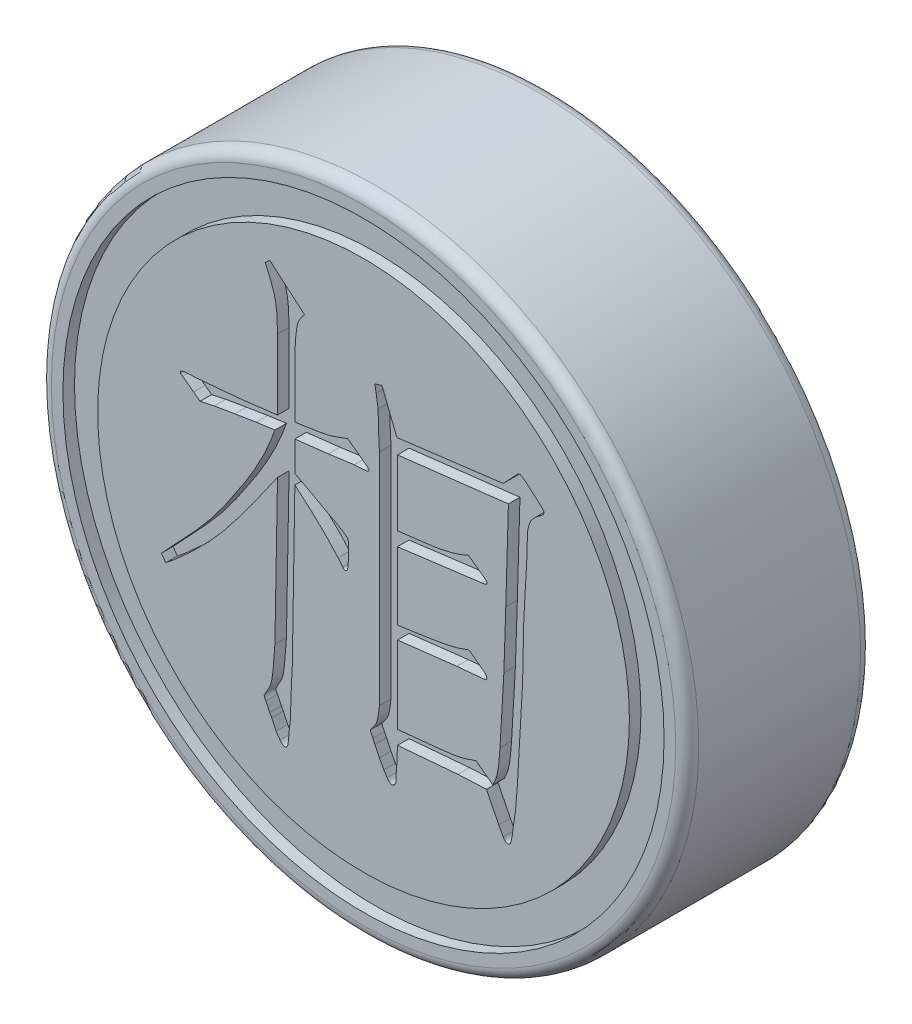
from build123d import *

# Parameters (mm, degrees)
SKETCH_1_R          = 14
EXTRUDE_1_DEPTH     = 8
SKETCH_2_R          = 13
SKETCH_2_R_2        = 11.5
CUT_EXTRUDE_1_DEPTH = 0.5
SKETCH_3_R          = 5.1
CUT_EXTRUDE_2_DEPTH = 5
CHAMFER_1_SIZE      = 0.5
FILLET_1_R          = 0.5
CUT_EXTRUDE_3_DEPTH = 0.5


with BuildPart() as part:
    # 草图1 → 凸台-拉伸1 (new body)
    with BuildSketch(Plane.XY):
        Circle(SKETCH_1_R)
    extrude(amount=EXTRUDE_1_DEPTH)

    # 草图2 → 切除-拉伸1 (cut)
    with BuildSketch(Plane.XY.offset(8)):
        Circle(SKETCH_2_R)
        Circle(SKETCH_2_R_2, mode=Mode.SUBTRACT)
    extrude(amount=-CUT_EXTRUDE_1_DEPTH, mode=Mode.SUBTRACT)

    # 草图3 → 切除-拉伸2 (cut)
    with BuildSketch(Plane(origin=(0, 0, 0), x_dir=(-1, 0, 0), z_dir=(0, 0, -1))):
        Circle(SKETCH_3_R)
    extrude(amount=-CUT_EXTRUDE_2_DEPTH, mode=Mode.SUBTRACT)

    # 倒角1
    chamfer_1_edges = [part.edges().sort_by_distance(p)[0] for p in [
        (5.1, 0, 0),
    ]]
    chamfer(chamfer_1_edges, length=CHAMFER_1_SIZE)

    # 圆角1
    fillet_1_edges = [part.edges().sort_by_distance(p)[0] for p in [
        (-14, 0, 0),
        (-14, 0, 8),
    ]]
    fillet(fillet_1_edges, radius=FILLET_1_R)

    # 草图4 → 切除-拉伸3 (cut)
    # profile 1 of 2: a face of its own
    with BuildSketch(Plane.XY.offset(8)):
        with BuildLine():
            Line((-8.741763508, -3.91180446), (-8.461985114, -3.612635485))
            add(Edge.make_bspline(
                [(-8.461985114, -3.612635485), (-8.305568525, -3.449550478), (-8.004894109, -3.136057583), (-7.57662194, -2.677774949), (-7.189035512, -2.249814977), (-6.889958007, -1.904577776), (-6.657298997, -1.629819899), (-6.482538726, -1.401698574), (-6.292182631, -1.154817783), (-6.094482886, -0.885169254), (-5.888299793, -0.591946348), (-5.673174333, -0.276412782), (-5.44582196, 0.060811982), (-5.137041564, 0.533197866), (-4.769099177, 1.122376929), (-4.38963282, 1.823765842), (-4.073861765, 2.494132509), (-3.911352622, 2.940127799), (-3.83317625, 3.154677535)],
                knots=[0, 0, 0, 0, 1.313030741, 2.523995405, 3.644633695, 4.667727952, 5.178141305, 5.736240464, 6.337183173, 6.989641019, 7.678853081, 8.419970333, 9.208657952, 10.042015548, 11.699317009, 13.242989632, 14.673717279, 16, 16, 16, 16], degree=3))
            Line((-3.83317625, 3.154677535), (-4.642040516, 3.043874211))
            Line((-4.642040516, 3.043874211), (-5.561708106, 2.894289723))
            Line((-5.561708106, 2.894289723), (-6.453674865, 2.744705235))
            Line((-6.453674865, 2.744705235), (-7.068633314, 2.611741247))
            Line((-7.068633314, 2.611741247), (-7.348411707, 2.819497479))
            Line((-7.348411707, 2.819497479), (-7.822095918, 3.174068116))
            add(Edge.make_bspline(
                [(-7.822095918, 3.174068116), (-7.846010322, 3.187616157), (-7.89065515, 3.212908444), (-7.922792978, 3.271253256), (-7.91704749, 3.323846887), (-7.875004632, 3.351342456), (-7.815229735, 3.368417236), (-7.766941075, 3.375154812), (-7.738993425, 3.379054266)],
                knots=[0, 0, 0, 0, 1.304813641, 2.435903511, 2.975626966, 3.668630338, 4.650691361, 6, 6, 6, 6], degree=3))
            Line((-7.738993425, 3.379054266), (-7.124034976, 3.417835429))
            Line((-7.124034976, 3.417835429), (-6.259769048, 3.492627673))
            Line((-6.259769048, 3.492627673), (-5.254228882, 3.584040416))
            Line((-5.254228882, 3.584040416), (-3.719602843, 3.772406067))
            Line((-3.719602843, 3.772406067), (-3.719602843, 6.800106898))
            add(Edge.make_bspline(
                [(-3.719602843, 6.800106898), (-3.720628017, 6.951601764), (-3.722536656, 7.233650583), (-3.750344313, 7.623847823), (-3.791016265, 7.950460922), (-3.875784377, 8.307495087), (-4.026546342, 8.724305577), (-4.174176069, 9.04497956), (-4.251458798, 9.21284928)],
                knots=[0, 0, 0, 0, 1.090728319, 2.030686865, 2.815939405, 3.457899522, 4.669235058, 6, 6, 6, 6], degree=3))
            Line((-4.251458798, 9.21284928), (-4.054782898, 9.401214931))
            Line((-4.054782898, 9.401214931), (-2.550627774, 8.110356205))
            add(Edge.make_bspline(
                [(-2.550627774, 8.110356205), (-2.589994462, 8.066216651), (-2.664568551, 7.982601107), (-2.747477665, 7.846840726), (-2.819992247, 7.723339618), (-2.86977562, 7.550277774), (-2.911246926, 7.31233088), (-2.938699577, 7.059132608), (-2.952016194, 6.845391587), (-2.960453571, 6.699502398), (-2.96633057, 6.574845619), (-2.968108403, 6.499095235), (-2.968910322, 6.464926842)],
                knots=[0, 0, 0, 0, 1.015934395, 1.924530261, 2.735490085, 3.469704258, 5.007192289, 6.894883221, 7.851071409, 8.695182599, 9.411441756, 10, 10, 10, 10], degree=3))
            Line((-2.968910322, 6.464926842), (-2.968910322, 3.883209391))
            add(Edge.make_bspline(
                [(-2.968910322, 3.883209391), (-2.87381694, 3.897156596), (-2.693837424, 3.923553926), (-2.438853871, 3.959450915), (-2.213976691, 3.990599488), (-2.02019385, 4.027582529), (-1.854785788, 4.04884591), (-1.720256955, 4.074899684), (-1.61612358, 4.097099291), (-1.470347136, 4.128352112), (-1.269496478, 4.193293166), (-1.050364572, 4.267043755), (-0.882830785, 4.327737342), (-0.785978504, 4.363945813), (-0.721739911, 4.387715728), (-0.690939847, 4.402047085), (-0.680821679, 4.406755097)],
                knots=[0, 0, 0, 0, 1.713266486, 3.242632287, 4.590446075, 5.759455582, 6.758105826, 7.561955233, 8.201147004, 8.656408814, 10.218811222, 11.9573515, 12.780023509, 13.394580114, 13.801112755, 14, 14, 14, 14], degree=3))
            Line((-0.680821679, 4.406755097), (0.100341756, 3.827807729))
            add(Edge.make_bspline(
                [(0.100341756, 3.827807729), (0.134938209, 3.80091075), (0.188297225, 3.759426837), (0.260264409, 3.674647156), (0.192487498, 3.605533577), (0.136750379, 3.604261769), (0.100341756, 3.603430997)],
                knots=[0, 0, 0, 0, 1.46868442, 2.26519038, 2.866786959, 4, 4, 4, 4], degree=3))
            Line((0.100341756, 3.603430997), (-0.401043286, 3.567419917))
            Line((-0.401043286, 3.567419917), (-1.517386776, 3.417835429))
            Line((-1.517386776, 3.417835429), (-2.968910322, 3.24886036))
            Line((-2.968910322, 3.24886036), (-2.968910322, 1.958001634))
            Line((-2.968910322, 1.958001634), (-2.437054366, 1.678223241))
            Line((-2.437054366, 1.678223241), (-1.099104228, 0.949691385))
            add(Edge.make_bspline(
                [(-1.099104228, 0.949691385), (-1.041399906, 0.916238047), (-0.939804112, 0.857339192), (-0.813956548, 0.772656123), (-0.726055553, 0.716519134), (-0.670538919, 0.653313098), (-0.65505362, 0.565948599), (-0.652526214, 0.461488431), (-0.653230069, 0.355008304), (-0.65315382, 0.286706517), (-0.653120848, 0.257170609)],
                knots=[0, 0, 0, 0, 1.744862611, 3.072052434, 3.971105692, 4.469315002, 5.219651188, 6.211664104, 7.226665558, 8, 8, 8, 8], degree=3))
            Line((-0.653120848, 0.257170609), (-0.653120848, -0.116790609))
            Line((-0.653120848, -0.116790609), (-0.680821679, -0.415959584))
            add(Edge.make_bspline(
                [(-0.680821679, -0.415959584), (-0.681103755, -0.438428084), (-0.681601162, -0.478048729), (-0.702480112, -0.528884324), (-0.733483812, -0.566486499), (-0.789539972, -0.582064831), (-0.861540064, -0.574546162), (-0.889589446, -0.530365135), (-0.902428328, -0.51014241)],
                knots=[0, 0, 0, 0, 1.121665303, 1.977929211, 2.73610904, 3.472518389, 4.843110523, 6, 6, 6, 6], degree=3))
            Line((-0.902428328, -0.51014241), (-1.099104228, -0.266375097))
            add(Edge.make_bspline(
                [(-1.099104228, -0.266375097), (-1.151575148, -0.205301617), (-1.261559712, -0.077285183), (-1.437409517, 0.120806495), (-1.642364192, 0.323345317), (-1.862512741, 0.544702745), (-2.110755561, 0.771878246), (-2.37457996, 1.017163227), (-2.664923816, 1.26864528), (-2.865401363, 1.440109647), (-2.968910322, 1.528638754)],
                knots=[0, 0, 0, 0, 0.744715405, 1.561001768, 2.44867498, 3.408808085, 4.448053837, 5.560178962, 6.740291169, 8, 8, 8, 8], degree=3))
            Line((-2.968910322, 1.528638754), (-3.079713646, -5.277455429))
            Line((-3.079713646, -5.277455429), (-3.135115308, -6.454740748))
            Line((-3.135115308, -6.454740748), (-3.162816139, -7.371638255))
            Line((-3.162816139, -7.371638255), (-3.218217801, -7.820391717))
            Line((-3.218217801, -7.820391717), (-3.245918632, -8.174962355))
            add(Edge.make_bspline(
                [(-3.245918632, -8.174962355), (-3.250729867, -8.22431155), (-3.259041722, -8.309566861), (-3.288555494, -8.413763876), (-3.334584315, -8.485301578), (-3.423974503, -8.502258806), (-3.526227679, -8.449477078), (-3.580161438, -8.380541345), (-3.608799519, -8.343937424)],
                knots=[0, 0, 0, 0, 1.369657157, 2.366209749, 3.022404389, 3.575466259, 4.71260609, 6, 6, 6, 6], degree=3))
            Line((-3.608799519, -8.343937424), (-3.777774588, -8.100170111))
            Line((-3.777774588, -8.100170111), (-3.971680405, -7.690197812))
            Line((-3.971680405, -7.690197812), (-4.054782898, -7.540613324))
            Line((-4.054782898, -7.540613324), (-4.223757967, -7.186042687))
            add(Edge.make_bspline(
                [(-4.223757967, -7.186042687), (-4.245405974, -7.154593792), (-4.280204624, -7.104040448), (-4.301100388, -7.026196542), (-4.275023221, -6.973062359), (-4.250123207, -6.916734925), (-4.205103104, -6.843459909), (-4.130718114, -6.717281452), (-4.034029737, -6.535783591), (-3.975867872, -6.326094572), (-3.945512522, -6.139187041), (-3.918341653, -5.975331754), (-3.905138415, -5.788051487), (-3.882280696, -5.52328353), (-3.865160732, -5.213406287), (-3.842990111, -4.973623403), (-3.83317625, -4.86748313)],
                knots=[0, 0, 0, 0, 0.669473849, 1.076163127, 1.299898459, 1.673520372, 2.15568584, 2.789319886, 4.226061601, 5.715447271, 6.547331891, 7.52190992, 8.602455272, 9.811048859, 12.145754146, 14, 14, 14, 14], degree=3))
            Line((-3.83317625, -4.86748313), (-3.719602843, 1.434455928))
            add(Edge.make_bspline(
                [(-3.719602843, 1.434455928), (-3.773265616, 1.358816346), (-3.894815855, 1.187486972), (-4.095570897, 0.898638885), (-4.344959227, 0.553841513), (-4.62211969, 0.148665938), (-4.937026055, -0.29158775), (-5.280097831, -0.752995689), (-5.646958983, -1.230965303), (-6.041048319, -1.728145116), (-6.481070078, -2.244120446), (-6.988796013, -2.771852296), (-7.558597138, -3.323964903), (-7.971022541, -3.687303776), (-8.184976804, -3.875793379)],
                knots=[0, 0, 0, 0, 0.479579861, 1.086284654, 1.818969097, 2.679936924, 3.624654721, 4.617831953, 5.653079685, 6.74031714, 7.898350074, 9.158083404, 10.52569661, 12, 12, 12, 12], degree=3))
            Line((-8.184976804, -3.875793379), (-8.54785769, -4.174962355))
            Line((-8.54785769, -4.174962355), (-8.741763508, -3.91180446))
        make_face()
    # profile 2 of 2: a face of its own
    with BuildSketch(Plane.XY.offset(8)):
        with BuildLine():
            Line((0.798402697, 7.138057036), (1.441061977, 5.512018255))
            Line((1.441061977, 5.512018255), (6.04217001, 6.090965623))
            Line((6.04217001, 6.090965623), (6.629427628, 6.708694155))
            add(Edge.make_bspline(
                [(6.629427628, 6.708694155), (6.64600575, 6.733881137), (6.675444156, 6.778606624), (6.747135604, 6.799198474), (6.80345413, 6.774813203), (6.862622471, 6.746264377), (6.936324034, 6.695551426), (6.989702869, 6.656228166), (7.020009346, 6.633901911)],
                knots=[0, 0, 0, 0, 1.132834522, 2.011617649, 2.573280891, 3.447023844, 4.550517029, 6, 6, 6, 6], degree=3))
            Line((7.020009346, 6.633901911), (7.687599373, 6.05218446))
            add(Edge.make_bspline(
                [(7.687599373, 6.05218446), (7.718387667, 6.021370178), (7.768444375, 5.971271217), (7.812113819, 5.879216658), (7.778660697, 5.796766394), (7.738519552, 5.758518942), (7.715300204, 5.736394986)],
                knots=[0, 0, 0, 0, 1.384551472, 2.25105325, 2.98833471, 4, 4, 4, 4], degree=3))
            Line((7.715300204, 5.736394986), (7.465992725, 5.548029335))
            add(Edge.make_bspline(
                [(7.465992725, 5.548029335), (7.408618129, 5.494260905), (7.303009678, 5.395290262), (7.194921035, 5.217969937), (7.139308219, 5.037086202), (7.102287435, 4.877338936), (7.089881809, 4.712520314), (7.082421646, 4.528730903), (7.077185706, 4.283043379), (7.076046425, 4.099276222), (7.075411008, 3.996782798)],
                knots=[0, 0, 0, 0, 1.132635956, 2.084823897, 2.958477353, 3.858938363, 4.448601112, 5.34370514, 6.518490679, 8, 8, 8, 8], degree=3))
            Line((7.075411008, 3.996782798), (6.934136769, 1.473237091))
            Line((6.934136769, 1.473237091), (6.878735107, -0.978286454))
            Line((6.878735107, -0.978286454), (6.657128459, -4.86748313))
            Line((6.657128459, -4.86748313), (6.571255883, -5.931195042))
            Line((6.571255883, -5.931195042), (6.48815339, -6.47413133))
            Line((6.48815339, -6.47413133), (6.432751728, -6.90349421))
            Line((6.432751728, -6.90349421), (6.377350066, -7.166652105))
            add(Edge.make_bspline(
                [(6.377350066, -7.166652105), (6.365308111, -7.203189915), (6.342420968, -7.2726343), (6.251684717, -7.31482902), (6.181240105, -7.30209681), (6.127423527, -7.272126459), (6.08194984, -7.216479266), (6.056201104, -7.171675922), (6.04217001, -7.147261524)],
                knots=[0, 0, 0, 0, 1.401201353, 2.663147213, 3.332791091, 4.049637261, 4.937201343, 6, 6, 6, 6], degree=3))
            Line((6.04217001, -7.147261524), (5.848264193, -6.792690886))
            Line((5.848264193, -6.792690886), (5.316408238, -5.726208892))
            Line((5.316408238, -5.726208892), (4.089261423, -5.781610554))
            Line((4.089261423, -5.781610554), (1.468762808, -6.005987285))
            Line((1.468762808, -6.005987285), (1.441061977, -6.698508061))
            Line((1.441061977, -6.698508061), (1.410591063, -7.127870942))
            Line((1.410591063, -7.127870942), (1.410591063, -7.391028837))
            add(Edge.make_bspline(
                [(1.410591063, -7.391028837), (1.39889379, -7.434493282), (1.376513804, -7.517652298), (1.294807221, -7.594236599), (1.211462852, -7.613761256), (1.145338255, -7.584705785), (1.080434737, -7.527920936), (1.041989359, -7.476073019), (1.020009346, -7.446430499)],
                knots=[0, 0, 0, 0, 1.3978301, 2.674419886, 3.295618976, 3.975860266, 4.842757693, 6, 6, 6, 6], degree=3))
            Line((1.020009346, -7.446430499), (0.88150519, -7.222053767))
            Line((0.88150519, -7.222053767), (0.687599373, -6.86748313))
            Line((0.687599373, -6.86748313), (0.490923473, -6.454740748))
            Line((0.490923473, -6.454740748), (0.40782098, -6.26914518))
            add(Edge.make_bspline(
                [(0.40782098, -6.26914518), (0.392328968, -6.238639874), (0.364705538, -6.184246604), (0.326494681, -6.114406048), (0.308908747, -6.063909866), (0.288300868, -6.014524297), (0.34673306, -5.939038413), (0.431299016, -5.839655932), (0.544659061, -5.681217055), (0.609157635, -5.460961969), (0.657775558, -5.198765699), (0.6771306, -5.007140578), (0.687599373, -4.90349421)],
                knots=[0, 0, 0, 0, 0.693877904, 1.237236827, 1.598241535, 1.793392947, 2.269950248, 3.280016533, 4.602012995, 6.103444859, 7.892427745, 10, 10, 10, 10], degree=3))
            Line((0.687599373, -4.90349421), (0.687599373, -4.136181191))
            Line((0.687599373, -4.136181191), (0.687599373, 4.595120748))
            add(Edge.make_bspline(
                [(0.687599373, 4.595120748), (0.682679587, 4.649576016), (0.671934128, 4.768513491), (0.661557104, 4.961610277), (0.654161812, 5.184215871), (0.645176928, 5.425173284), (0.641436071, 5.661626805), (0.634840463, 5.871179144), (0.63175932, 6.041094532), (0.632065639, 6.141749833), (0.632197711, 6.185148449)],
                knots=[0, 0, 0, 0, 0.824545758, 1.800916468, 2.915734389, 4.183637511, 5.437236178, 6.482015167, 7.345504502, 8, 8, 8, 8], degree=3))
            Line((0.632197711, 6.185148449), (0.546325135, 6.725314654))
            Line((0.546325135, 6.725314654), (0.490923473, 7.043874211))
            Line((0.490923473, 7.043874211), (0.798402697, 7.138057036))
        make_face()
        with BuildLine():
            Line((1.468762808, -5.407649335), (3.308097988, -5.222053767))
            add(Edge.make_bspline(
                [(3.308097988, -5.222053767), (3.430079227, -5.208992621), (3.658799912, -5.184502345), (3.977020127, -5.138640252), (4.246673218, -5.085447034), (4.407152903, -5.038384758), (4.479843141, -5.017067618)],
                knots=[0, 0, 0, 0, 1.235390887, 2.316417284, 3.237411089, 4, 4, 4, 4], degree=3))
            Line((4.479843141, -5.017067618), (4.676519041, -4.942275374))
            Line((4.676519041, -4.942275374), (4.870424858, -4.884103629))
            Line((4.870424858, -4.884103629), (5.596186631, -5.427039917))
            add(Edge.make_bspline(
                [(5.596186631, -5.427039917), (5.646678263, -5.317724851), (5.74898854, -5.096221716), (5.82525321, -4.723354596), (5.872518731, -4.31539348), (5.892861376, -4.028284186), (5.903665855, -3.875793379)],
                knots=[0, 0, 0, 0, 0.904283442, 1.832333126, 2.848698814, 4, 4, 4, 4], degree=3))
            Line((5.903665855, -3.875793379), (6.069870841, -0.994906953))
            Line((6.069870841, -0.994906953), (6.152973334, 1.528638754))
            Line((6.152973334, 1.528638754), (6.266546742, 5.437226011))
            Line((6.266546742, 5.437226011), (1.468762808, 4.874899141))
            Line((1.468762808, 4.874899141), (1.468762808, 2.032793878))
            Line((1.468762808, 2.032793878), (2.723610454, 2.182378366))
            add(Edge.make_bspline(
                [(2.723610454, 2.182378366), (2.905092638, 2.205305714), (3.249826462, 2.248857276), (3.733502968, 2.356108169), (4.1607341, 2.48036146), (4.415342198, 2.596044017), (4.535244803, 2.65052241)],
                knots=[0, 0, 0, 0, 1.167023804, 2.216815832, 3.160244984, 4, 4, 4, 4], degree=3))
            Line((4.535244803, 2.65052241), (5.261006575, 2.126976704))
            add(Edge.make_bspline(
                [(5.261006575, 2.126976704), (5.291280887, 2.102556816), (5.338509068, 2.064461586), (5.350704016, 1.962350016), (5.243115357, 1.917609703), (5.169131541, 1.908402754), (5.12250242, 1.902599972)],
                knots=[0, 0, 0, 0, 1.109956098, 1.731540895, 2.570278482, 4, 4, 4, 4], degree=3))
            Line((5.12250242, 1.902599972), (1.468762808, 1.434455928))
            Line((1.468762808, 1.434455928), (1.468762808, -1.501832161))
            Line((1.468762808, -1.501832161), (2.779012116, -1.31346651))
            add(Edge.make_bspline(
                [(2.779012116, -1.31346651), (2.955725123, -1.287724087), (3.293051506, -1.238584532), (3.767051614, -1.13831183), (4.188506612, -1.029115752), (4.44272415, -0.930662806), (4.562945634, -0.884103629)],
                knots=[0, 0, 0, 0, 1.16455421, 2.223010426, 3.159647578, 4, 4, 4, 4], degree=3))
            Line((4.562945634, -0.884103629), (5.261006575, -1.407649335))
            add(Edge.make_bspline(
                [(5.261006575, -1.407649335), (5.283205644, -1.435631346), (5.322383488, -1.485015166), (5.339689743, -1.57065746), (5.304460201, -1.64304262), (5.257732124, -1.648541956), (5.233305744, -1.651416648)],
                knots=[0, 0, 0, 0, 1.326984778, 2.341918165, 3.133263398, 4, 4, 4, 4], degree=3))
            Line((5.233305744, -1.651416648), (4.033859761, -1.762219972))
            Line((4.033859761, -1.762219972), (1.468762808, -2.061388947))
            Line((1.468762808, -2.061388947), (1.468762808, -5.407649335))
        make_face(mode=Mode.SUBTRACT)
    extrude(amount=-CUT_EXTRUDE_3_DEPTH, mode=Mode.SUBTRACT)


solid = part.part
